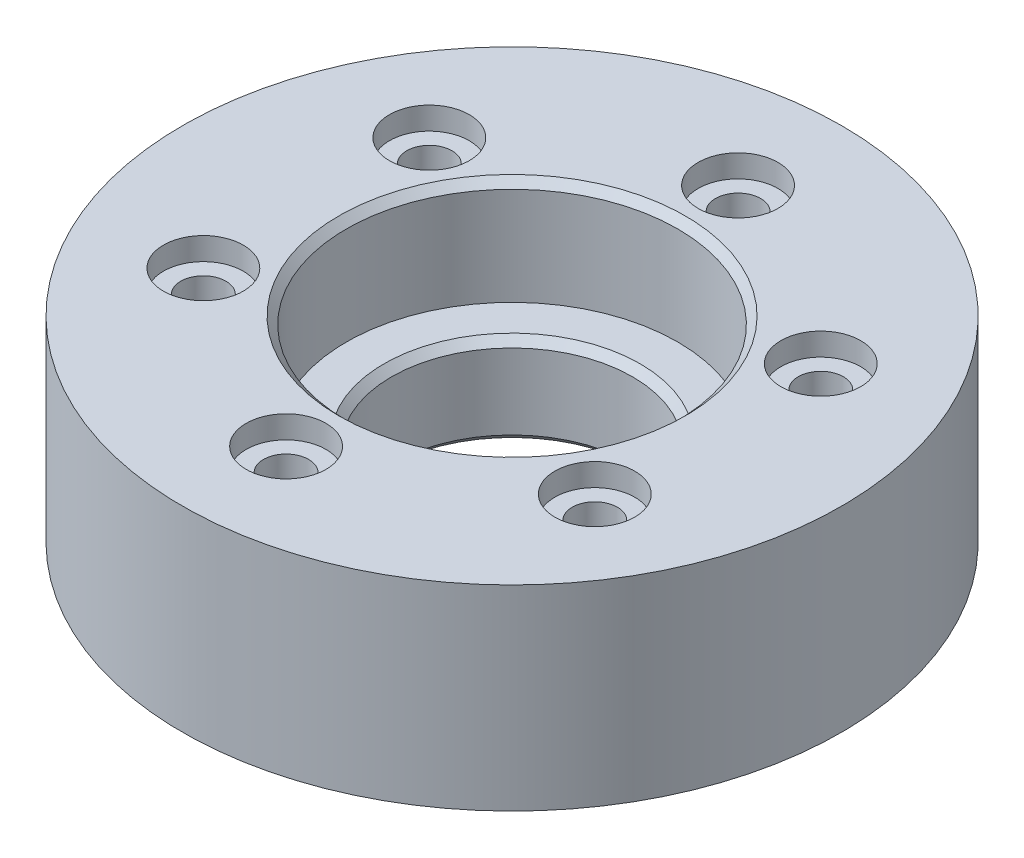
from build123d import *

# Parameters (mm, degrees)
SKETCH1_R           = 21.875
BOSS_EXTRUDE1_DEPTH = 13
SKETCH2_R           = 11
CUT_EXTRUDE1_DEPTH  = 7
CUT_EXTRUDE2_REACH  = 33.718
SKETCH3_R           = 8
CUT_EXTRUDE3_REACH  = 35.556
SKETCH4_R           = 1.5
CIRPATTERN1_COUNT   = 6
CHAMFER1_SIZE       = 0.5
SKETCH5_R           = 2.65
CUT_EXTRUDE4_DEPTH  = 1.5
CIRPATTERN2_COUNT   = 6
CUT_EXTRUDE5_DEPTH  = 1.5


with BuildPart() as part:
    # Sketch1 → Boss-Extrude1 (new body)
    with BuildSketch(Plane(origin=(0, 0, 0), x_dir=(1, 0, 0), z_dir=(0, 1, 0))):
        with Locations(Location((0, 0, 0), (0, 0, 90))):
            Circle(SKETCH1_R)
    extrude(amount=BOSS_EXTRUDE1_DEPTH)

    # Sketch2 → Cut-Extrude1 (cut)
    with BuildSketch(Plane(origin=(0, 13, 0), x_dir=(1, 0, 0), z_dir=(0, 1, 0))):
        with Locations(Location((0, 0, 0), (0, 0, 270))):
            Circle(SKETCH2_R)
    extrude(amount=-CUT_EXTRUDE1_DEPTH, mode=Mode.SUBTRACT)

    # Sketch3 → Cut-Extrude2 (cut, up to next)
    with BuildSketch(Plane(origin=(0, 6, 0), x_dir=(1, 0, 0), z_dir=(0, 1, 0)), mode=Mode.PRIVATE) as cut_extrude2_sk1:
        with Locations(Location((0, 0, 0), (0, 0, 270))):
            Circle(SKETCH3_R)
    cut_extrude2_tool1 = extrude(cut_extrude2_sk1.sketch, amount=-CUT_EXTRUDE2_REACH, mode=Mode.PRIVATE) & part.part
    add(cut_extrude2_tool1.solids().sort_by_distance((0, 6, 0))[0], mode=Mode.SUBTRACT)

    # Sketch4 → Cut-Extrude3 (cut, up to next)
    with BuildSketch(Plane(origin=(0, 13, 0), x_dir=(1, 0, 0), z_dir=(0, 1, 0)), mode=Mode.PRIVATE) as cut_extrude3_sk1:
        with Locations(Location((0, 15, 0), (0, 0, 270))):
            Circle(SKETCH4_R)
    cut_extrude3_tool1 = extrude(cut_extrude3_sk1.sketch, amount=-CUT_EXTRUDE3_REACH, mode=Mode.PRIVATE) & part.part
    cut_extrude3 = cut_extrude3_tool1.solids().sort_by_distance((0, 13, -15))[0]
    add(cut_extrude3, mode=Mode.SUBTRACT)

    # CirPattern1: Cut-Extrude3 ×6 about axis
    cirpattern1_axis = Axis((0, 0, 0), (0, 1, 0))
    for i in range(1, CIRPATTERN1_COUNT):
        add(cut_extrude3.rotate(cirpattern1_axis, i * 360 / CIRPATTERN1_COUNT), mode=Mode.SUBTRACT)

    # Chamfer1
    chamfer1_edges = [part.edges().sort_by_distance(p)[0] for p in [
        (0, 6, -8),
        (0, 0, -8),
        (0, 13, -11),
    ]]
    chamfer(chamfer1_edges, length=CHAMFER1_SIZE)

    # Sketch5 → Cut-Extrude4 (cut)
    with BuildSketch(Plane(origin=(0, 13, 0), x_dir=(1, 0, 0), z_dir=(0, 1, 0))):
        with Locations(Location((0, 15, 0), (0, 0, 270))):
            Circle(SKETCH5_R)
    cut_extrude4 = extrude(amount=-CUT_EXTRUDE4_DEPTH, mode=Mode.SUBTRACT)

    # CirPattern2: Cut-Extrude4 ×6 about axis
    cirpattern2_axis = Axis((0, 0, 0), (0, 1, 0))
    for i in range(1, CIRPATTERN2_COUNT):
        add(cut_extrude4.rotate(cirpattern2_axis, i * 360 / CIRPATTERN2_COUNT), mode=Mode.SUBTRACT)

    # Sketch6 → Cut-Extrude5 (cut)
    with BuildSketch(Plane(origin=(0, 0, 0), x_dir=(-1, 0, 0), z_dir=(0, -1, 0))):
        Polygon((14.635829324, 10.35), (11.34493279, 10.35), (9.699484522, 7.5), (11.34493279, 4.65), (14.635829324, 4.65), (16.281277591, 7.5), align=None)
        Polygon((3.290896534, 15), (1.645448267, 17.85), (-1.645448267, 17.85), (-3.290896534, 15), (-1.645448267, 12.15), (1.645448267, 12.15), align=None)
        Polygon((-11.34493279, 10.35), (-14.635829324, 10.35), (-16.281277591, 7.5), (-14.635829324, 4.65), (-11.34493279, 4.65), (-9.699484522, 7.5), align=None)
    cut_extrude5 = extrude(amount=-CUT_EXTRUDE5_DEPTH, mode=Mode.SUBTRACT)

    # Mirror1: Cut-Extrude5 across plane
    add(cut_extrude5.mirror(Plane.XY), mode=Mode.SUBTRACT)


solid = part.part
